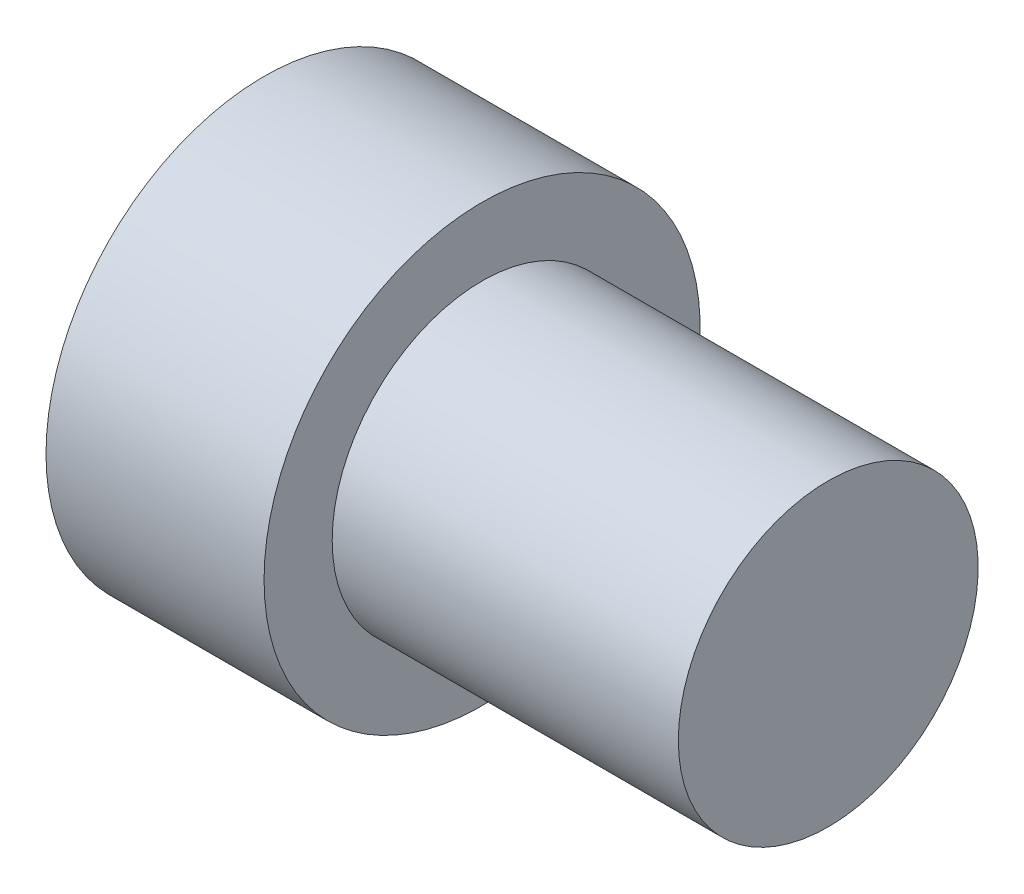
from build123d import *


with BuildPart() as part:
    # Burst_Disc Sketch → Burst_Disc (revolve)
    with BuildSketch(Plane.XY):
        Polygon((12.7, 0), (12.7, 5.5), (0, 5.5), (0, 8), (-8, 8), (-8, 0), align=None)
    revolve(axis=Axis((-1000, 0, 0), (1, 0, 0)))


solid = part.part
